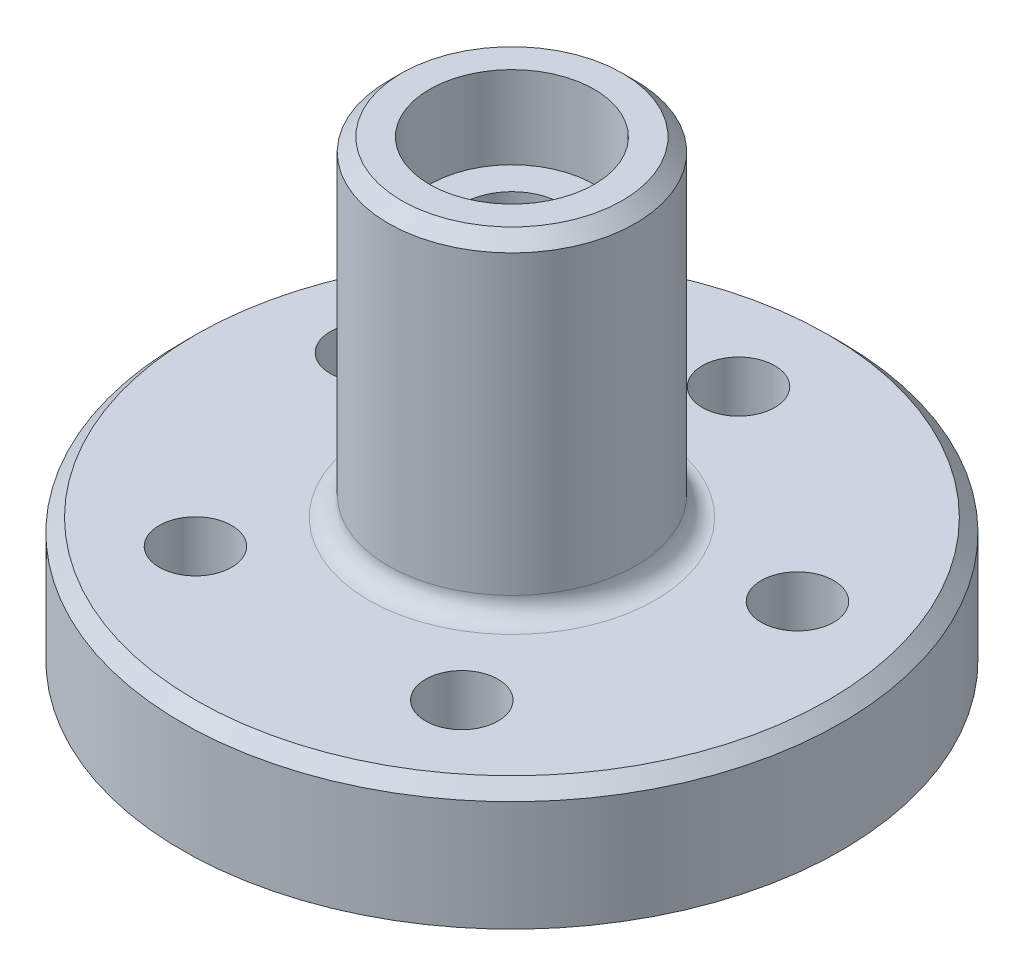
from build123d import *

# Parameters (mm, degrees)
SKETCH1_R           = 50.8
BOSS_EXTRUDE1_DEPTH = 19.05
CHAMFER1_SIZE       = 2.032
SKETCH2_R           = 5.588
CUT_EXTRUDE2_DEPTH  = 75.324844433
SKETCH4_R           = 19.05
BOSS_EXTRUDE2_DEPTH = 50.8
FILLET1_R           = 3.048
CHAMFER2_SIZE       = 2.032
SKETCH5_R           = 12.7
CUT_EXTRUDE3_DEPTH  = 12.7
SKETCH6_R           = 7.62
CUT_EXTRUDE4_DEPTH  = 92.800885072


with BuildPart() as part:
    # Sketch1 → Boss-Extrude1 (new body)
    with BuildSketch(Plane(origin=(0, 0, 0), x_dir=(1, 0, 0), z_dir=(0, 1, 0))):
        with Locations(Location((0, 0, 0), (0, 0, 90))):
            Circle(SKETCH1_R)
    extrude(amount=BOSS_EXTRUDE1_DEPTH)

    # Chamfer1
    chamfer1_edges = [part.edges().sort_by_distance(p)[0] for p in [
        (0, 19.05, 50.8),
    ]]
    chamfer(chamfer1_edges, length=CHAMFER1_SIZE)

    # Sketch2 → Cut-Extrude2 (cut, through all)
    with BuildSketch(Plane(origin=(0, 19.05, 0), x_dir=(1, 0, 0), z_dir=(0, 1, 0))):
        with Locations(Location((0, 34.925, 0), (0, 0, 270))):
            Circle(SKETCH2_R)
        with Locations(Location((33.215648832, 10.792418529, 0), (0, 0, 270))):
            Circle(SKETCH2_R)
        with Locations(Location((20.528399936, -28.254918529, 0), (0, 0, 270))):
            Circle(SKETCH2_R)
        with Locations(Location((-20.528399936, -28.254918529, 0), (0, 0, 270))):
            Circle(SKETCH2_R)
        with Locations(Location((-33.215648832, 10.792418529, 0), (0, 0, 270))):
            Circle(SKETCH2_R)
    extrude(amount=-CUT_EXTRUDE2_DEPTH, mode=Mode.SUBTRACT)

    # Sketch4 → Boss-Extrude2 (add)
    with BuildSketch(Plane(origin=(0, 19.05, 0), x_dir=(1, 0, 0), z_dir=(0, 1, 0))):
        with Locations(Location((0, 0, 0), (0, 0, 270))):
            Circle(SKETCH4_R)
    extrude(amount=BOSS_EXTRUDE2_DEPTH)

    # Fillet1
    fillet1_edges = [part.edges().sort_by_distance(p)[0] for p in [
        (0, 19.05, -19.05),
    ]]
    fillet(fillet1_edges, radius=FILLET1_R)

    # Chamfer2
    chamfer2_edges = [part.edges().sort_by_distance(p)[0] for p in [
        (0, 69.85, -19.05),
    ]]
    chamfer(chamfer2_edges, length=CHAMFER2_SIZE)

    # Sketch5 → Cut-Extrude3 (cut)
    with BuildSketch(Plane(origin=(0, 69.85, 0), x_dir=(1, 0, 0), z_dir=(0, 1, 0))):
        with Locations(Location((0, 0, 0), (0, 0, 270))):
            Circle(SKETCH5_R)
    extrude(amount=-CUT_EXTRUDE3_DEPTH, mode=Mode.SUBTRACT)

    # Sketch6 → Cut-Extrude4 (cut, through all)
    with BuildSketch(Plane(origin=(0, 57.15, 0), x_dir=(1, 0, 0), z_dir=(0, 1, 0))):
        with Locations(Location((0, 0, 0), (0, 0, 270))):
            Circle(SKETCH6_R)
    extrude(amount=-CUT_EXTRUDE4_DEPTH, mode=Mode.SUBTRACT)


solid = part.part
